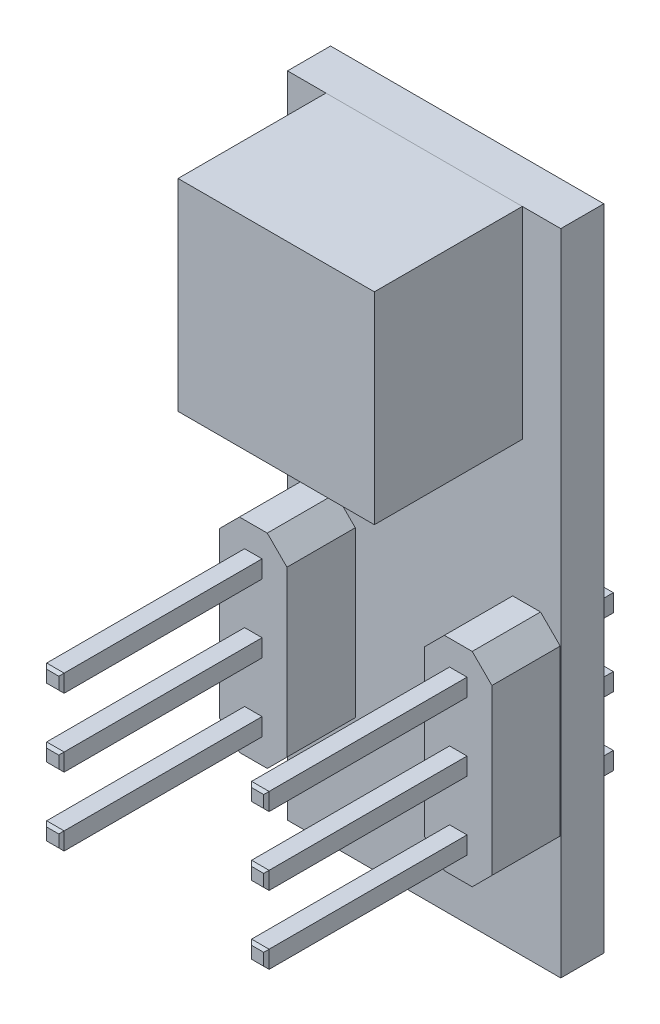
from build123d import *

# Parameters (mm, degrees)
SKETCH2_W                = 10.16
SKETCH2_H                = 24.13
SKETCH2_R                = 0.5
BOSS_EXTRUDE1_DEPTH      = 1.6
SKETCH3_W                = 7.3
SKETCH3_H                = 7.5
BOSS_EXTRUDE2_DEPTH      = 5.5
BOSS_EXTRUDE3_DEPTH      = 2.54
SKETCH9_W                = 0.65
SKETCH9_H                = 0.65
BOSS_EXTRUDE4_DEPTH      = 10
SKETCH9_2_W              = 0.65
SKETCH9_2_H              = 0.65
BOSS_EXTRUDE5_DEPTH      = 3
CHAMFER1_SIZE            = 0.1
CHAMFER1_OF_MIRROR2_SIZE = 0.1


with BuildPart() as part:
    # Sketch2 → Boss-Extrude1 (new body)
    with BuildSketch(Plane.XY):
        with Locations((5.08, 12.065)):
            Rectangle(SKETCH2_W, SKETCH2_H)
        with Locations((1.27, 5.08)):
            Circle(SKETCH2_R, mode=Mode.SUBTRACT)
        with Locations((1.27, 7.62)):
            Circle(SKETCH2_R, mode=Mode.SUBTRACT)
        with Locations((1.27, 10.16)):
            Circle(SKETCH2_R, mode=Mode.SUBTRACT)
        with Locations((8.89, 10.16)):
            Circle(SKETCH2_R, mode=Mode.SUBTRACT)
        with Locations((8.89, 7.62)):
            Circle(SKETCH2_R, mode=Mode.SUBTRACT)
        with Locations((8.89, 5.08)):
            Circle(SKETCH2_R, mode=Mode.SUBTRACT)
    extrude(amount=BOSS_EXTRUDE1_DEPTH)

    # Sketch8 → Boss-Extrude3 (add)
    with BuildSketch(Plane.XY.offset(1.6)):
        Polygon((0.02, 10.677766953), (0.02, 4.562233047), (0.752233047, 3.83), (1.787766953, 3.83), (2.52, 4.562233047), (2.52, 10.677766953), (1.787766953, 11.41), (0.752233047, 11.41), align=None)
    boss_extrude3 = extrude(amount=BOSS_EXTRUDE3_DEPTH)

    # Sketch9 → Boss-Extrude4 (add)
    with BuildSketch(Plane.XY.offset(1.6)):
        with Locations((1.27, 10.16)):
            Rectangle(SKETCH9_W, SKETCH9_H)
        with Locations((1.27, 7.62)):
            Rectangle(SKETCH9_W, SKETCH9_H)
        with Locations((1.27, 5.08)):
            Rectangle(SKETCH9_W, SKETCH9_H)
    boss_extrude4 = extrude(amount=BOSS_EXTRUDE4_DEPTH)

    # Sketch9<2> → Boss-Extrude5 (add)
    with BuildSketch(Plane.XY.offset(1.6)):
        with Locations((1.27, 10.16)):
            Rectangle(SKETCH9_2_W, SKETCH9_2_H)
        with Locations((1.27, 7.62)):
            Rectangle(SKETCH9_2_W, SKETCH9_2_H)
        with Locations((1.27, 5.08)):
            Rectangle(SKETCH9_2_W, SKETCH9_2_H)
    boss_extrude5 = extrude(amount=-BOSS_EXTRUDE5_DEPTH)

    # Chamfer1
    chamfer1_edges = [part.edges().sort_by_distance(p)[0] for p in [
        (0.945, 5.08, 11.6),
        (1.27, 4.755, 11.6),
        (1.595, 5.08, 11.6),
        (1.27, 5.405, 11.6),
        (0.945, 10.16, -1.4),
        (1.27, 10.485, -1.4),
        (1.595, 10.16, -1.4),
        (1.27, 9.835, -1.4),
        (0.945, 7.62, -1.4),
        (1.27, 7.945, -1.4),
        (1.595, 7.62, -1.4),
        (1.27, 7.295, -1.4),
        (0.945, 5.08, -1.4),
        (1.27, 5.405, -1.4),
        (1.595, 5.08, -1.4),
        (1.27, 4.755, -1.4),
        (0.945, 10.16, 11.6),
        (1.27, 9.835, 11.6),
        (1.595, 10.16, 11.6),
        (1.27, 10.485, 11.6),
        (0.945, 7.62, 11.6),
        (1.27, 7.295, 11.6),
        (1.595, 7.62, 11.6),
        (1.27, 7.945, 11.6),
    ]]
    chamfer(chamfer1_edges, length=CHAMFER1_SIZE)

    # Mirror1: Boss-Extrude3 across plane
    add(boss_extrude3.mirror(Plane(origin=(5.08, 0, 0), x_dir=(0, 0, 1), z_dir=(1, 0, 0))))

    # Mirror2: Boss-Extrude4, Boss-Extrude5 across plane
    add(boss_extrude4.mirror(Plane(origin=(5.08, 0, 0), x_dir=(0, 0, 1), z_dir=(1, 0, 0))))
    add(boss_extrude5.mirror(Plane(origin=(5.08, 0, 0), x_dir=(0, 0, 1), z_dir=(1, 0, 0))))

    # Chamfer1 of Mirror2
    chamfer1_of_mirror2_edges = [part.edges().sort_by_distance(p)[0] for p in [
        (9.215, 5.08, 11.6),
        (8.89, 4.755, 11.6),
        (8.565, 5.08, 11.6),
        (8.89, 5.405, 11.6),
        (9.215, 10.16, -1.4),
        (8.89, 10.485, -1.4),
        (8.565, 10.16, -1.4),
        (8.89, 9.835, -1.4),
        (9.215, 7.62, -1.4),
        (8.89, 7.945, -1.4),
        (8.565, 7.62, -1.4),
        (8.89, 7.295, -1.4),
        (9.215, 5.08, -1.4),
        (8.89, 5.405, -1.4),
        (8.565, 5.08, -1.4),
        (8.89, 4.755, -1.4),
        (9.215, 10.16, 11.6),
        (8.89, 9.835, 11.6),
        (8.565, 10.16, 11.6),
        (8.89, 10.485, 11.6),
        (9.215, 7.62, 11.6),
        (8.89, 7.295, 11.6),
        (8.565, 7.62, 11.6),
        (8.89, 7.945, 11.6),
    ]]
    chamfer(chamfer1_of_mirror2_edges, length=CHAMFER1_OF_MIRROR2_SIZE)


with BuildPart() as body_2:
    # Sketch3 → Boss-Extrude2 (new body)
    with BuildSketch(Plane.XY.offset(1.6)):
        with Locations((5.08, 20.38)):
            Rectangle(SKETCH3_W, SKETCH3_H)
    extrude(amount=BOSS_EXTRUDE2_DEPTH)


solid = Compound([part.part, body_2.part])
